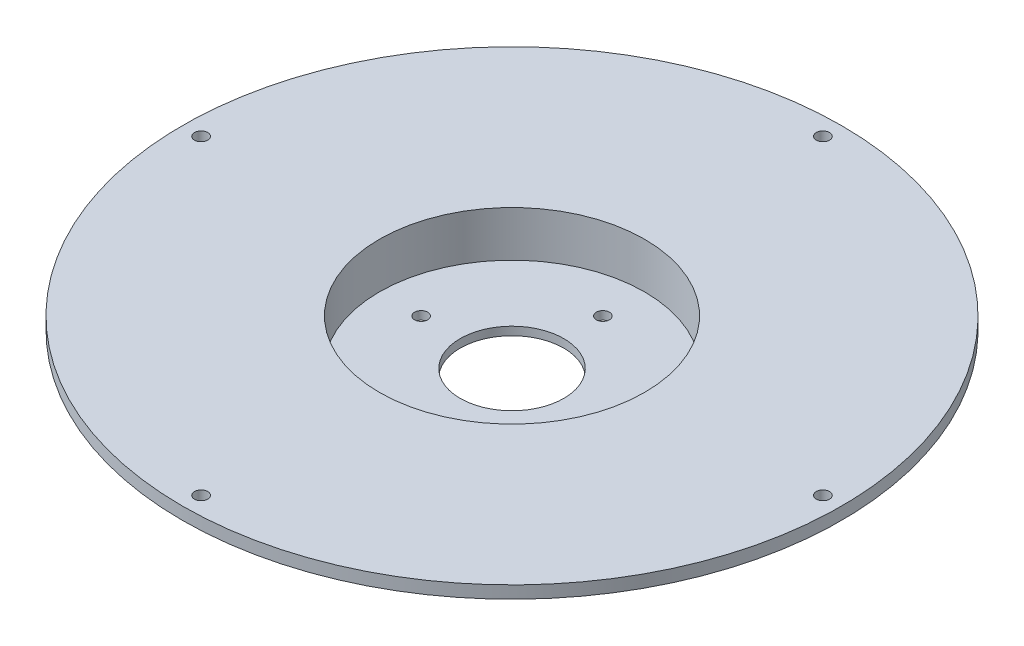
from build123d import *

# Parameters (mm, degrees)
SKETCH_1_R          = 79.5
SKETCH_1_R_2        = 1.6
EXTRUDE_1_DEPTH     = 3
SKETCH_5_R          = 34
EXTRUDE_2_DEPTH     = 10
CUT_EXTRUDE_START   = -22
SKETCH_7_R          = 1.6
CUT_EXTRUDE_1_DEPTH = 22
SKETCH_8_R          = 32
CUT_EXTRUDE_2_DEPTH = 11
SKETCH_10_R         = 12.5
CUT_EXTRUDE_3_DEPTH = 12


with BuildPart() as part:
    # 草图1 → 凸台-拉伸1 (new body)
    with BuildSketch(Plane(origin=(0, 0, 0), x_dir=(1, 0, 0), z_dir=(0, 1, 0))):
        with Locations(Location((0, 0, 0), (0, 0, 270))):
            Circle(SKETCH_1_R)
        with Locations(Location((0, 75, 0), (0, 0, 270))):
            Circle(SKETCH_1_R_2, mode=Mode.SUBTRACT)
        with Locations(Location((75, 0, 0), (0, 0, 270))):
            Circle(SKETCH_1_R_2, mode=Mode.SUBTRACT)
        with Locations(Location((0, -75, 0), (0, 0, 270))):
            Circle(SKETCH_1_R_2, mode=Mode.SUBTRACT)
        with Locations(Location((-75, 0, 0), (0, 0, 270))):
            Circle(SKETCH_1_R_2, mode=Mode.SUBTRACT)
        with Locations(Location((0, 21.92, 0), (0, 0, 270))):
            Circle(SKETCH_1_R_2, mode=Mode.SUBTRACT)
        with Locations(Location((21.92, 0, 0), (0, 0, 270))):
            Circle(SKETCH_1_R_2, mode=Mode.SUBTRACT)
        with Locations(Location((0, -21.92, 0), (0, 0, 270))):
            Circle(SKETCH_1_R_2, mode=Mode.SUBTRACT)
        with Locations(Location((-21.92, 0, 0), (0, 0, 270))):
            Circle(SKETCH_1_R_2, mode=Mode.SUBTRACT)
    extrude(amount=EXTRUDE_1_DEPTH)

    # 草图5 → 凸台-拉伸2 (add)
    with BuildSketch(Plane.XZ):
        with Locations(Location((0, 0, 0), (0, 0, 90))):
            Circle(SKETCH_5_R)
    extrude(amount=EXTRUDE_2_DEPTH)

    # 草图7 → 切除-拉伸1 (cut)
    with BuildSketch(Plane(origin=(0, 3, 0), x_dir=(1, 0, 0), z_dir=(0, 1, 0)).offset(CUT_EXTRUDE_START)):
        with Locations(Location((0, 21.92, 0), (0, 0, 90))):
            Circle(SKETCH_7_R)
        with Locations(Location((21.92, 0, 0), (0, 0, 90))):
            Circle(SKETCH_7_R)
        with Locations(Location((0, -21.92, 0), (0, 0, 90))):
            Circle(SKETCH_7_R)
        with Locations(Location((-21.92, 0, 0), (0, 0, 90))):
            Circle(SKETCH_7_R)
    extrude(amount=CUT_EXTRUDE_1_DEPTH, mode=Mode.SUBTRACT)

    # 草图8 → 切除-拉伸2 (cut)
    with BuildSketch(Plane(origin=(0, 3, 0), x_dir=(1, 0, 0), z_dir=(0, 1, 0))):
        with Locations(Location((0, 0, 0), (0, 0, 270))):
            Circle(SKETCH_8_R)
    extrude(amount=-CUT_EXTRUDE_2_DEPTH, mode=Mode.SUBTRACT)

    # 草图10 → 切除-拉伸3 (cut)
    with BuildSketch(Plane(origin=(0, -8, 0), x_dir=(1, 0, 0), z_dir=(0, 1, 0))):
        with Locations(Location((0, 0, 0), (0, 0, 270))):
            Circle(SKETCH_10_R)
    extrude(amount=-CUT_EXTRUDE_3_DEPTH, mode=Mode.SUBTRACT)


solid = part.part
